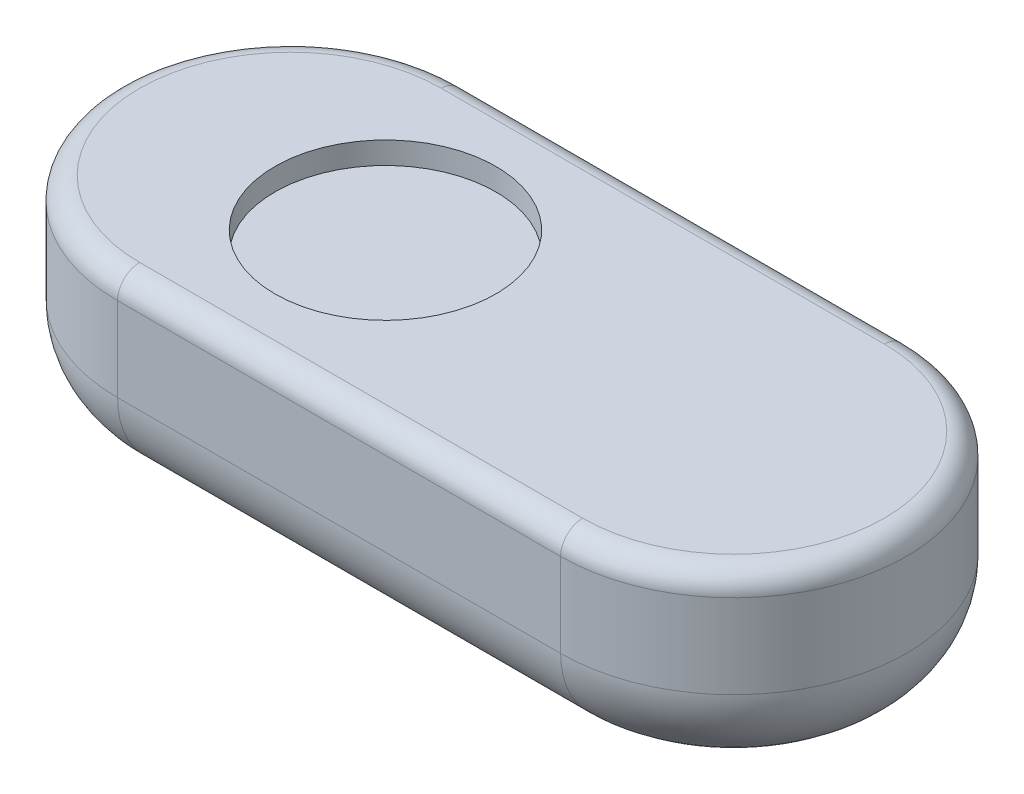
from build123d import *

# Parameters (mm, degrees)
EXTRUDE_1_DEPTH     = 17.6
FILLET_2_R          = 2
FILLET_3_R          = 8
SKETCH_2_R          = 10
CUT_EXTRUDE_1_DEPTH = 2


with BuildPart() as part:
    # 草圖1 → 填料-伸長1 (new body)
    with BuildSketch(Plane(origin=(0, 0, 0), x_dir=(1, 0, 0), z_dir=(0, 1, 0))):
        with BuildLine():
            Line((-20.05, 15.65), (20.05, 15.65))
            ThreePointArc((20.05, 15.65), (35.7, 0), (20.05, -15.65))
            Line((20.05, -15.65), (-20.05, -15.65))
            ThreePointArc((-20.05, -15.65), (-35.7, 0), (-20.05, 15.65))
        make_face()
    extrude(amount=EXTRUDE_1_DEPTH)

    # 圓角2
    fillet_2_edges = [part.edges().sort_by_distance(p)[0] for p in [
        (35.7, 17.6, 0),
        (0, 17.6, -15.65),
        (-35.7, 17.6, 0),
        (0, 17.6, 15.65),
    ]]
    fillet(fillet_2_edges, radius=FILLET_2_R)

    # 圓角3
    fillet_3_edges = [part.edges().sort_by_distance(p)[0] for p in [
        (0, 0, -15.65),
        (35.7, 0, 0),
        (0, 0, 15.65),
        (-35.7, 0, 0),
    ]]
    fillet(fillet_3_edges, radius=FILLET_3_R)

    # 草圖2 → 除料-伸長1 (cut)
    with BuildSketch(Plane(origin=(0, 17.6, 0), x_dir=(1, 0, 0), z_dir=(0, 1, 0))):
        with Locations(Location((-11.455400627, 0, 0), (0, 0, 270))):
            Circle(SKETCH_2_R)
    extrude(amount=-CUT_EXTRUDE_1_DEPTH, mode=Mode.SUBTRACT)


solid = part.part
